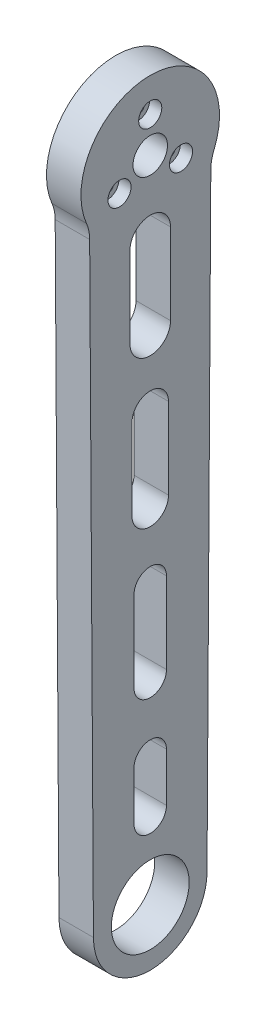
from build123d import *

# Parameters (mm, degrees)
SKETCH_3_R          = 9.6
EXTRUDE_1_DEPTH     = 8.5
SKETCH_4_R          = 4.25
SKETCH_4_R_2        = 1.6
CUT_EXTRUDE_1_DEPTH = 10
SKETCH_5_R          = 2.85
CUT_EXTRUDE_2_DEPTH = 3
CUT_EXTRUDE_3_DEPTH = 10
FILLET_1_R          = 10


with BuildPart() as part:
    # 草图3 → 凸台-拉伸1 (new body)
    with BuildSketch(Plane(origin=(0, 0, 0), x_dir=(0, 0, -1), z_dir=(1, 0, 0))):
        with BuildLine():
            Line((14, -160), (14.948368861, -8.260982254))
            ThreePointArc((14.948368861, -8.260982254), (0, 17.0791557), (-14.948368861, -8.260982254))
            Line((-14.948368861, -8.260982254), (-14, -160))
            ThreePointArc((-14, -160), (0, -174), (14, -160))
        make_face()
        with Locations((0, -160)):
            Circle(SKETCH_3_R, mode=Mode.SUBTRACT)
    extrude(amount=EXTRUDE_1_DEPTH)

    # 草图4 → 切除-拉伸1 (cut)
    with BuildSketch(Plane(origin=(8.5, 0, 0), x_dir=(0, 0, -1), z_dir=(1, 0, 0))):
        Circle(SKETCH_4_R)
        with Locations((0, 8.75)):
            Circle(SKETCH_4_R_2)
        with Locations((7.577722283, -4.375)):
            Circle(SKETCH_4_R_2)
        with Locations((-7.577722283, -4.375)):
            Circle(SKETCH_4_R_2)
    extrude(amount=-CUT_EXTRUDE_1_DEPTH, mode=Mode.SUBTRACT)

    # 草图5 → 切除-拉伸2 (cut)
    with BuildSketch(Plane(origin=(8.5, 0, 0), x_dir=(0, 0, -1), z_dir=(1, 0, 0))):
        with Locations((0, 8.75)):
            Circle(SKETCH_5_R)
        with Locations((7.577722283, -4.375)):
            Circle(SKETCH_5_R)
        with Locations((-7.577722283, -4.375)):
            Circle(SKETCH_5_R)
    extrude(amount=-CUT_EXTRUDE_2_DEPTH, mode=Mode.SUBTRACT)

    # 草图6 → 切除-拉伸3 (cut)
    with BuildSketch(Plane(origin=(8.5, 0, 0), x_dir=(0, 0, -1), z_dir=(1, 0, 0))):
        with BuildLine():
            Line((5, -17.788825977), (5, -37.788825977))
            ThreePointArc((5, -37.788825977), (0, -42.788825977), (-5, -37.788825977))
            Line((-5, -37.788825977), (-5, -17.788825977))
            ThreePointArc((-5, -17.788825977), (0, -12.788825977), (5, -17.788825977))
        make_face()
        with BuildLine():
            Line((4.5, -54.788825977), (4.5, -74.788825977))
            ThreePointArc((4.5, -74.788825977), (0, -79.288825977), (-4.5, -74.788825977))
            Line((-4.5, -74.788825977), (-4.5, -54.788825977))
            ThreePointArc((-4.5, -54.788825977), (0, -50.288825977), (4.5, -54.788825977))
        make_face()
        with BuildLine():
            Line((4, -91.788825977), (4, -111.788825977))
            ThreePointArc((4, -111.788825977), (0, -115.788825977), (-4, -111.788825977))
            Line((-4, -111.788825977), (-4, -91.788825977))
            ThreePointArc((-4, -91.788825977), (0, -87.788825977), (4, -91.788825977))
        make_face()
        with BuildLine():
            Line((4, -128.788825977), (4, -140.788825977))
            ThreePointArc((4, -140.788825977), (0, -144.788825977), (-4, -140.788825977))
            Line((-4, -140.788825977), (-4, -128.788825977))
            ThreePointArc((-4, -128.788825977), (0, -124.788825977), (4, -128.788825977))
        make_face()
    extrude(amount=-CUT_EXTRUDE_3_DEPTH, mode=Mode.SUBTRACT)

    # 圆角1
    fillet_1_edges = [part.edges().sort_by_distance(p)[0] for p in [
        (4.25, -8.260982254, 14.948368861),
        (4.25, -8.260982254, -14.948368861),
    ]]
    fillet(fillet_1_edges, radius=FILLET_1_R)


solid = part.part
